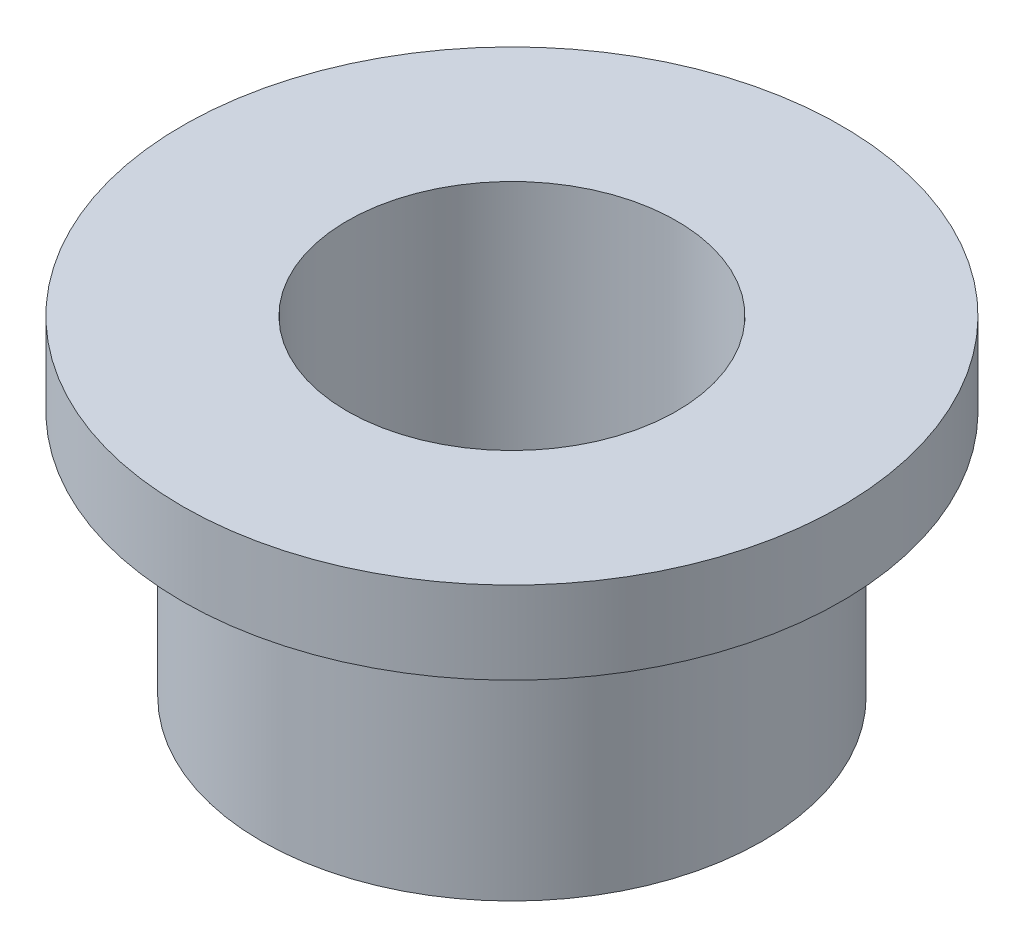
from build123d import *

# Parameters (mm, degrees)
SKETCH1_R           = 4.826
SKETCH1_R_2         = 3.175
BOSS_EXTRUDE1_DEPTH = 6.35
BOSS_EXTRUDE2_START = -1.5875
SKETCH2_R           = 6.35
SKETCH2_R_2         = 4.826
BOSS_EXTRUDE2_DEPTH = 1.5875


with BuildPart() as part:
    # Sketch1 → Boss-Extrude1 (new body)
    with BuildSketch(Plane(origin=(0, 0, 0), x_dir=(1, 0, 0), z_dir=(0, 1, 0))):
        with Locations(Location((0, 0, 0), (0, 0, 270))):
            Circle(SKETCH1_R)
        with Locations(Location((0, 0, 0), (0, 0, 270))):
            Circle(SKETCH1_R_2, mode=Mode.SUBTRACT)
    extrude(amount=BOSS_EXTRUDE1_DEPTH)

    # Sketch2 → Boss-Extrude2 (add)
    with BuildSketch(Plane(origin=(0, 6.35, 0), x_dir=(1, 0, 0), z_dir=(0, 1, 0)).offset(BOSS_EXTRUDE2_START)):
        with Locations(Location((0, 0, 0), (0, 0, 270))):
            Circle(SKETCH2_R)
        with Locations(Location((0, 0, 0), (0, 0, 270))):
            Circle(SKETCH2_R_2, mode=Mode.SUBTRACT)
    extrude(amount=BOSS_EXTRUDE2_DEPTH)


solid = part.part
